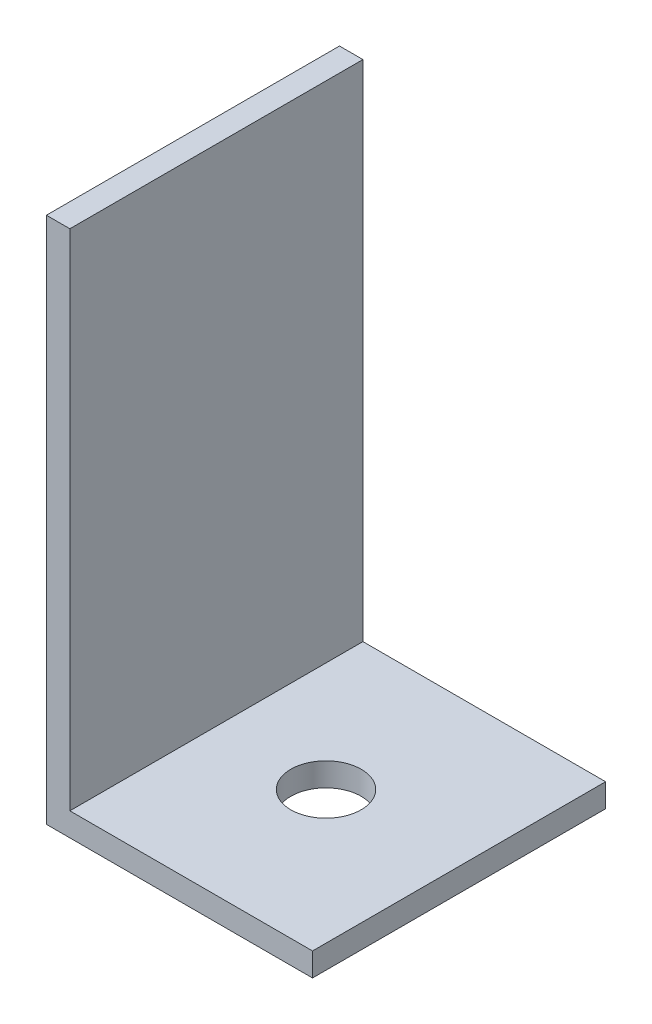
from build123d import *

# Parameters (mm, degrees)
SKETCH_1_W      = 22.7
SKETCH_1_H      = 25
SKETCH_1_R      = 3
EXTRUDE_1_DEPTH = 2
SKETCH_2_W      = 2
SKETCH_2_H      = 25
EXTRUDE_2_DEPTH = 43


with BuildPart() as part:
    # ｽｹｯﾁ1 → ﾎﾞｽ - 押し出し1 (new body)
    with BuildSketch(Plane(origin=(0, 0, 0), x_dir=(1, 0, 0), z_dir=(0, 1, 0))):
        Rectangle(SKETCH_1_W, SKETCH_1_H)
        with Locations(Location((0, 0, 0), (0, 0, 270))):
            Circle(SKETCH_1_R, mode=Mode.SUBTRACT)
    extrude(amount=EXTRUDE_1_DEPTH)

    # ｽｹｯﾁ2 → ﾎﾞｽ - 押し出し2 (add)
    with BuildSketch(Plane(origin=(0, 2, 0), x_dir=(1, 0, 0), z_dir=(0, 1, 0))):
        with Locations((-10.35, 0)):
            Rectangle(SKETCH_2_W, SKETCH_2_H)
    extrude(amount=EXTRUDE_2_DEPTH)


solid = part.part
